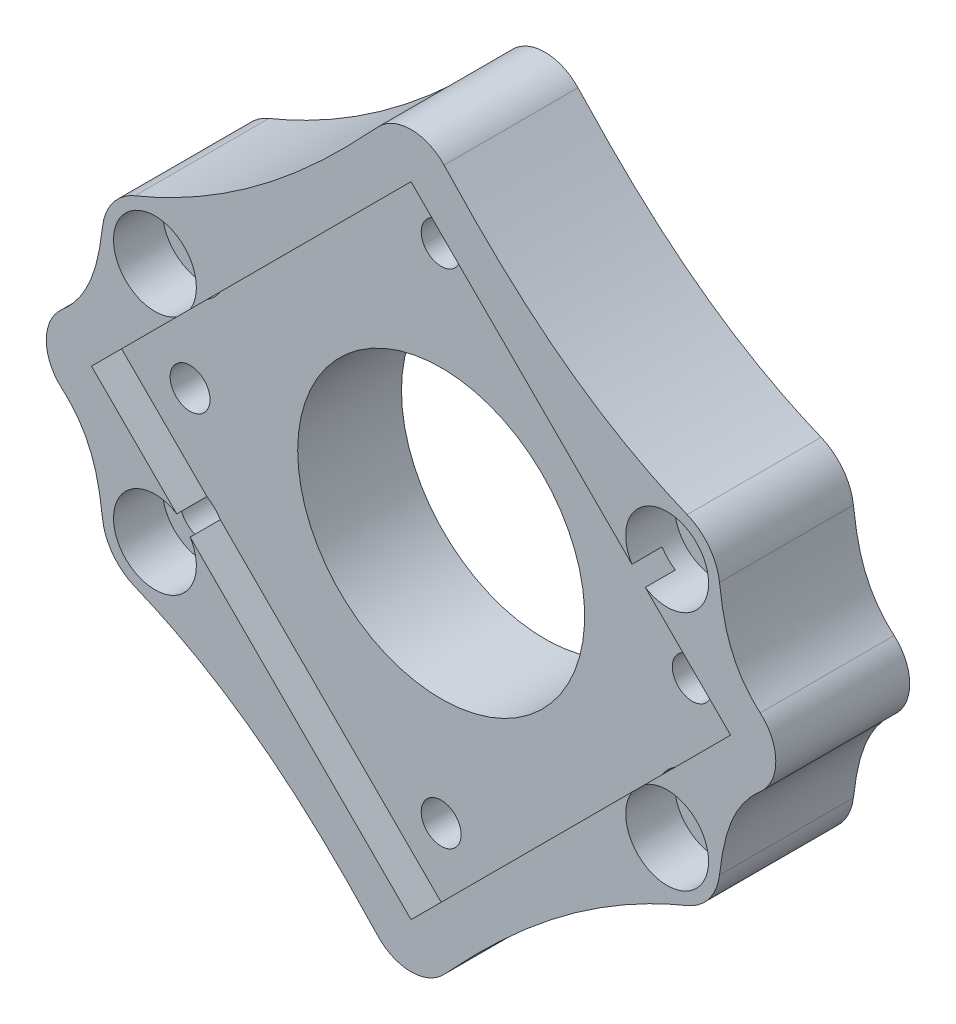
from build123d import *

# Parameters (mm, degrees)
MAIN_FEATURES_SKETCH_R         = 19.05
MAIN_BODY_DEPTH                = 17.78
SKETCH1_8_R                    = 31
SKETCH1_8_R_2                  = 25
RING_POCKET_DEPTH              = 2
CBORE_FOR_M6_SHCS1_D           = 6.4
CBORE_FOR_M6_SHCS1_CBORE_D     = 11
CBORE_FOR_M6_SHCS1_CBORE_DEPTH = 6.5
CBORE_FOR_M5_SHCS1_D           = 5.3
CBORE_FOR_M5_SHCS1_CBORE_D     = 10
CBORE_FOR_M5_SHCS1_CBORE_DEPTH = 5.5
CUT_EXTRUDE5_START             = 17.78
CUT_EXTRUDE5_DEPTH             = 4


with BuildPart() as part:
    # main_features_sketch → main_body (new body)
    with BuildSketch(Plane.XY):
        with BuildLine():
            add(Edge.make_bspline(
                [(4.384277331, -46.522516279), (11.494410565, -38.912173671), (21.620981626, -28.654243233), (36.660389066, -22.474745556)],
                knots=[0, 0, 0, 0, 1, 1, 1, 1], degree=3))
            ThreePointArc((36.660389066, -22.474745556), (39.572504615, -20.236412671), (40.950412855, -16.831721795))
            add(Edge.make_bspline(
                [(40.950412855, -16.831721795), (41.488925466, -12.331557199), (42.397215407, -7.970955774), (46.359831988, -4.530802009)],
                knots=[0, 0, 0, 0, 1, 1, 1, 1], degree=3))
            ThreePointArc((46.359831988, -4.530802009), (48.426406871, 0), (46.359831988, 4.530802009))
            add(Edge.make_bspline(
                [(40.950412855, 16.831721795), (41.488925466, 12.331557199), (42.397215407, 7.970955774), (46.359831988, 4.530802009)],
                knots=[0, 0, 0, 0, 1, 1, 1, 1], degree=3))
            ThreePointArc((40.950412855, 16.831721795), (39.572504615, 20.236412671), (36.660389066, 22.474745556))
            add(Edge.make_bspline(
                [(4.384277331, 46.522516279), (11.494410565, 38.912173671), (21.620981626, 28.654243233), (36.660389066, 22.474745556)],
                knots=[0, 0, 0, 0, 1, 1, 1, 1], degree=3))
            ThreePointArc((4.384277331, 46.522516279), (0, 48.426406871), (-4.384277331, 46.522516279))
            add(Edge.make_bspline(
                [(-4.384277331, 46.522516279), (-11.494410565, 38.912173671), (-21.620981626, 28.654243233), (-36.660389066, 22.474745556)],
                knots=[0, 0, 0, 0, 1, 1, 1, 1], degree=3))
            ThreePointArc((-36.660389066, 22.474745556), (-39.572504615, 20.236412671), (-40.950412855, 16.831721795))
            add(Edge.make_bspline(
                [(-40.950412855, 16.831721795), (-41.488925466, 12.331557199), (-42.397215407, 7.970955774), (-46.359831988, 4.530802009)],
                knots=[0, 0, 0, 0, 1, 1, 1, 1], degree=3))
            ThreePointArc((-46.359831988, 4.530802009), (-48.426406871, 0), (-46.359831988, -4.530802009))
            add(Edge.make_bspline(
                [(-40.950412855, -16.831721795), (-41.488925466, -12.331557199), (-42.397215407, -7.970955774), (-46.359831988, -4.530802009)],
                knots=[0, 0, 0, 0, 1, 1, 1, 1], degree=3))
            ThreePointArc((-40.950412855, -16.831721795), (-39.572504615, -20.236412671), (-36.660389066, -22.474745556))
            add(Edge.make_bspline(
                [(-4.384277331, -46.522516279), (-11.494410565, -38.912173671), (-21.620981626, -28.654243233), (-36.660389066, -22.474745556)],
                knots=[0, 0, 0, 0, 1, 1, 1, 1], degree=3))
            ThreePointArc((-4.384277331, -46.522516279), (0, -48.426406871), (4.384277331, -46.522516279))
        make_face()
        with Locations(Location((0, 0, 0), (0, 0, 180))):
            Circle(MAIN_FEATURES_SKETCH_R, mode=Mode.SUBTRACT)
    extrude(amount=MAIN_BODY_DEPTH)

    # Sketch1<8> → ring_pocket (cut)
    with BuildSketch(Plane.XY):
        Circle(SKETCH1_8_R)
        Circle(SKETCH1_8_R_2, mode=Mode.SUBTRACT)
    extrude(amount=RING_POCKET_DEPTH, mode=Mode.SUBTRACT)

    # CBORE for M6 SHCS1 (through all)
    with Locations(Plane.XY.offset(17.78)):
        with Locations((-34, 16), (-34, -16), (34, -16), (34, 16)):
            CounterBoreHole(CBORE_FOR_M6_SHCS1_D / 2, CBORE_FOR_M6_SHCS1_CBORE_D / 2, CBORE_FOR_M6_SHCS1_CBORE_DEPTH)

    # CBORE for M5 SHCS1 (through all)
    with Locations(Plane(origin=(0, 0, 0), x_dir=(-1, 0, 0), z_dir=(0, 0, -1))):
        with Locations((0, 33.335), (33.335, 0), (0, -33.335), (-33.335, 0)):
            CounterBoreHole(CBORE_FOR_M5_SHCS1_D / 2, CBORE_FOR_M5_SHCS1_CBORE_D / 2, CBORE_FOR_M5_SHCS1_CBORE_DEPTH)

    # main_features_sketch<9> → Cut-Extrude5 (cut)
    with BuildSketch(Plane.XY.offset(CUT_EXTRUDE5_START)):
        Polygon((0, 42.426406871), (42.426406871, 0), (0, -42.426406871), (-42.426406871, 0), align=None)
    extrude(amount=-CUT_EXTRUDE5_DEPTH, mode=Mode.SUBTRACT)


solid = part.part
